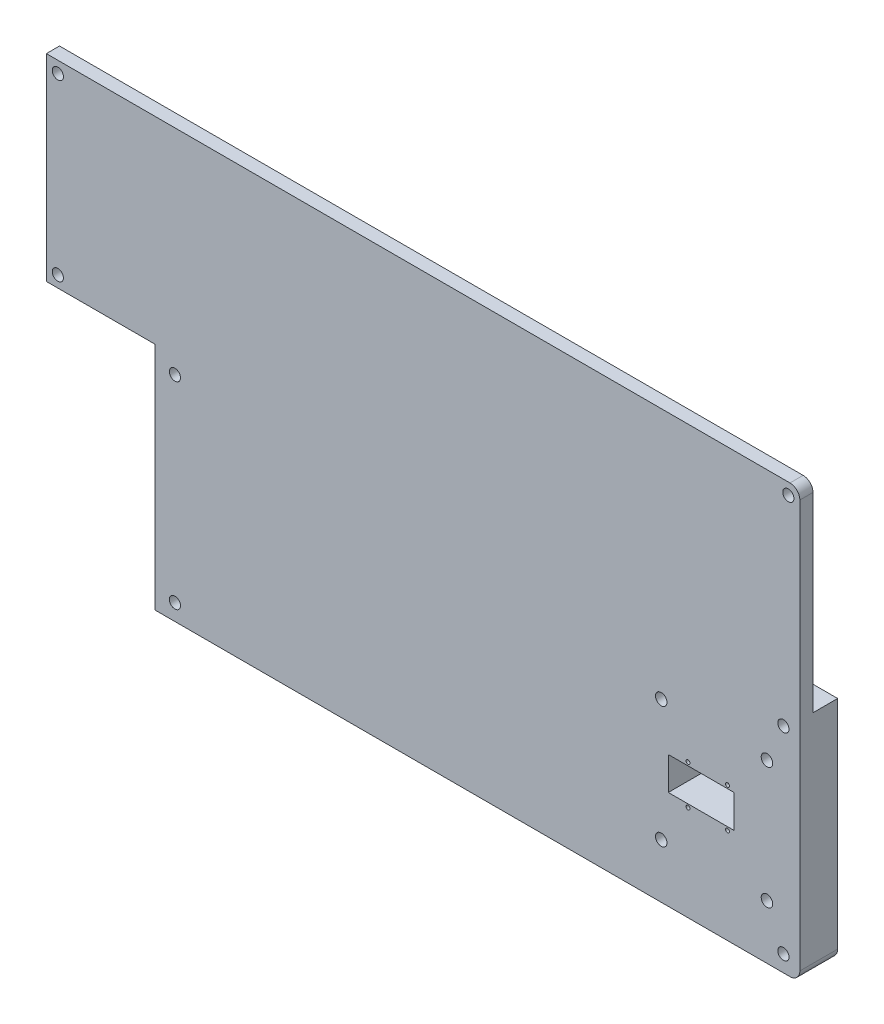
from build123d import *

# Parameters (mm, degrees)
SKETCH_1_W          = 196
SKETCH_1_H          = 130
EXTRUDE_1_DEPTH     = 4
SKETCH_3_W          = 196
SKETCH_3_H          = 69
EXTRUDE_2_DEPTH     = 7.5
SKETCH_4_W          = 4
SKETCH_4_H          = 60
EXTRUDE_3_DEPTH     = 33.1
SKETCH_2_R          = 1.7
CUT_EXTRUDE_1_DEPTH = 236.474520915
SKETCH_5_R          = 1.7
CUT_EXTRUDE_2_DEPTH = 236.474520915
FILLET_1_R          = 3
SKETCH_7_R          = 0.6
SKETCH_7_W          = 20
SKETCH_7_H          = 10
CUT_EXTRUDE_3_DEPTH = 236.474520915
SKETCH_8_R          = 1.75
CUT_EXTRUDE_4_DEPTH = 40


with BuildPart() as part:
    # ｽｹｯﾁ1 → ﾎﾞｽ - 押し出し1 (new body)
    with BuildSketch(Plane.XY):
        with Locations((98, 65)):
            Rectangle(SKETCH_1_W, SKETCH_1_H)
    extrude(amount=EXTRUDE_1_DEPTH)

    # ｽｹｯﾁ3 → ﾎﾞｽ - 押し出し2 (add)
    with BuildSketch(Plane(origin=(0, 0, 0), x_dir=(-1, 0, 0), z_dir=(0, 0, -1))):
        with Locations((-98, 34.5)):
            Rectangle(SKETCH_3_W, SKETCH_3_H)
    extrude(amount=EXTRUDE_2_DEPTH)

    # ｽｹｯﾁ4 → ﾎﾞｽ - 押し出し3 (add)
    with BuildSketch(Plane.ZY):
        with Locations((2, 100)):
            Rectangle(SKETCH_4_W, SKETCH_4_H)
    extrude(amount=EXTRUDE_3_DEPTH)

    # ｽｹｯﾁ2 → ｶｯﾄ - 押し出し1 (cut, through all)
    with BuildSketch(Plane.XY.offset(4)):
        with Locations((191, 5)):
            Circle(SKETCH_2_R)
        with Locations((192.5, 126.5)):
            Circle(SKETCH_2_R)
        with Locations((191, 65)):
            Circle(SKETCH_2_R)
        with Locations((6, 5)):
            Circle(SKETCH_2_R)
        with Locations((6, 65)):
            Circle(SKETCH_2_R)
    extrude(amount=-CUT_EXTRUDE_1_DEPTH, mode=Mode.SUBTRACT)

    # ｽｹｯﾁ5 → ｶｯﾄ - 押し出し2 (cut, through all)
    with BuildSketch(Plane.XY.offset(4)):
        with Locations((-29.6, 126.5)):
            Circle(SKETCH_5_R)
        with Locations((-29.6, 73.5)):
            Circle(SKETCH_5_R)
    extrude(amount=-CUT_EXTRUDE_2_DEPTH, mode=Mode.SUBTRACT)

    # ﾌｨﾚｯﾄ1
    fillet_1_edges = [part.edges().sort_by_distance(p)[0] for p in [
        (196, 130, 2),
        (196, 0, -1.75),
    ]]
    fillet(fillet_1_edges, radius=FILLET_1_R)

    # ｽｹｯﾁ7 → ｶｯﾄ - 押し出し3 (cut, through all)
    with BuildSketch(Plane.XY.offset(4)):
        with Locations((174, 41)):
            Circle(SKETCH_7_R)
        with Locations((162, 41)):
            Circle(SKETCH_7_R)
        with Locations((174, 29)):
            Circle(SKETCH_7_R)
        with Locations((162, 29)):
            Circle(SKETCH_7_R)
        with Locations((166, 35)):
            Rectangle(SKETCH_7_W, SKETCH_7_H)
    extrude(amount=-CUT_EXTRUDE_3_DEPTH, mode=Mode.SUBTRACT)

    # ｽｹｯﾁ8 → ｶｯﾄ - 押し出し4 (cut)
    with BuildSketch(Plane.XY.offset(4)):
        with Locations((186, 53.5)):
            Circle(SKETCH_8_R)
        with Locations((153.85, 53.5)):
            Circle(SKETCH_8_R)
        with Locations((153.85, 16.5)):
            Circle(SKETCH_8_R)
        with Locations((186, 16.5)):
            Circle(SKETCH_8_R)
    extrude(amount=-CUT_EXTRUDE_4_DEPTH, mode=Mode.SUBTRACT)


solid = part.part
